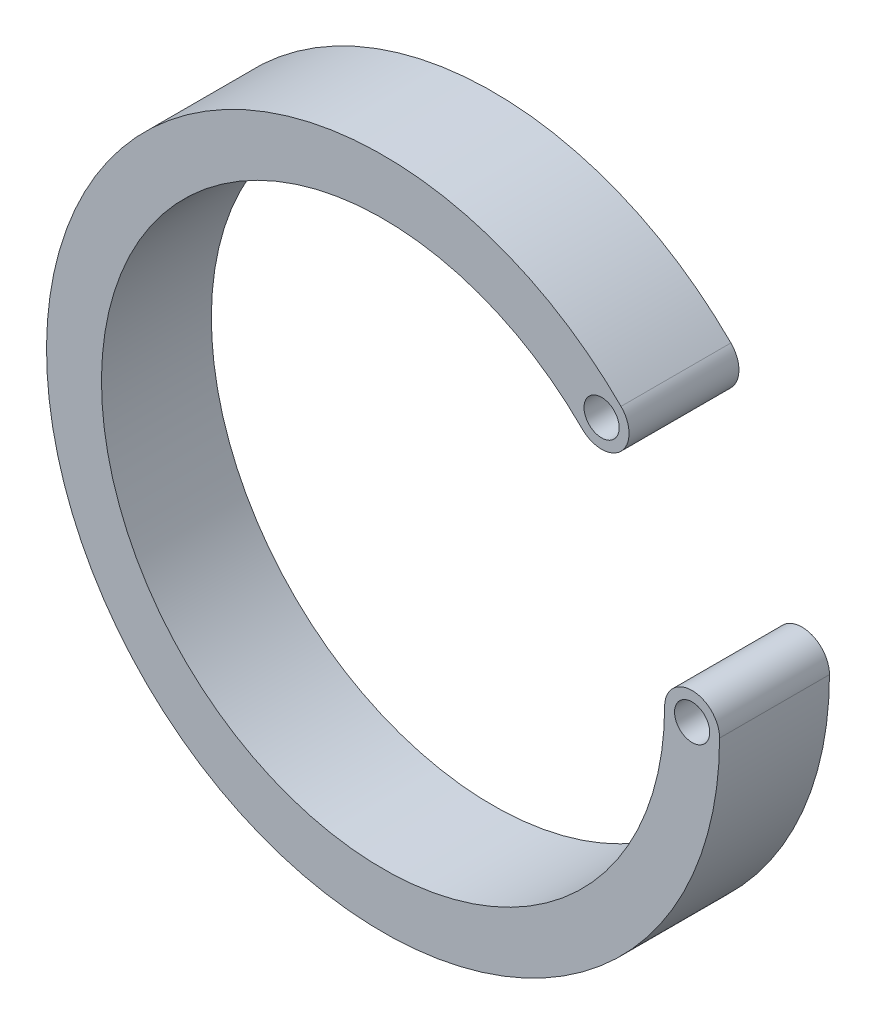
from build123d import *

# Parameters (mm, degrees)
SKETCH1_R           = 2.032
BOSS_EXTRUDE1_DEPTH = 12.7


with BuildPart() as part:
    # Sketch1 → Boss-Extrude1 (new body)
    with BuildSketch(Plane.XY):
        with BuildLine():
            ThreePointArc((27.502034371, 27.502034371), (27.502034371, 23.01190631), (23.01190631, 23.01190631))
            ThreePointArc((23.01190631, 23.01190631), (-30.066504536, -12.453953952), (32.54375, 0))
            ThreePointArc((32.54375, 0), (35.71875, 3.175), (38.89375, 0))
            ThreePointArc((38.89375, 0), (-35.933139568, -14.883993748), (27.502034371, 27.502034371))
        make_face()
        with Locations((25.256970341, 25.256970341)):
            Circle(SKETCH1_R, mode=Mode.SUBTRACT)
        with Locations((35.71875, 0)):
            Circle(SKETCH1_R, mode=Mode.SUBTRACT)
    extrude(amount=BOSS_EXTRUDE1_DEPTH)


solid = part.part
